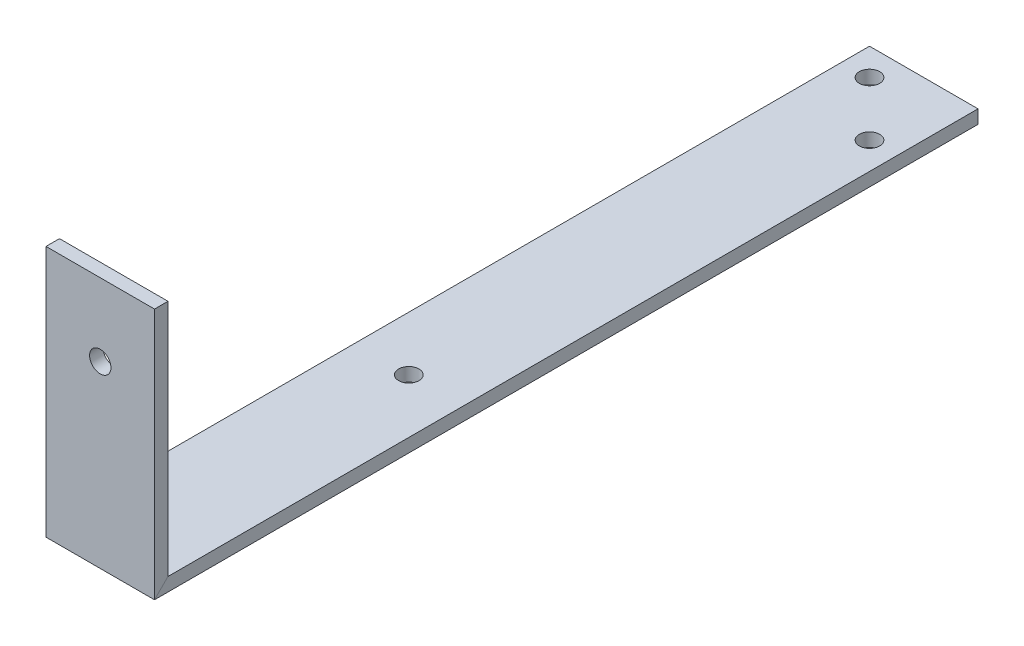
from build123d import *

# Parameters (mm, degrees)
CROQUIS2_W              = 50.8
CROQUIS2_H              = 6.31
CROQUIS3_W              = 50.8
CROQUIS3_H              = 6.31
CROQUIS4_W              = 60
CROQUIS4_H              = 53.155
SALIENTE_EXTRUIR1_DEPTH = 6.31
CROQUIS5_W              = 60
CROQUIS5_H              = 6.31
CORTAR_EXTRUIR1_DEPTH   = 6.31
CORTAR_EXTRUIR2_DEPTH   = 634
CROQUIS8_W              = 50.8
CROQUIS8_H              = 6.31
SALIENTE_EXTRUIR2_DEPTH = 63.5
CROQUIS9_R              = 5
CORTAR_EXTRUIR3_DEPTH   = 10
CROQUIS10_W             = 790.847933
CROQUIS10_H             = 6.31
CORTAR_EXTRUIR4_DEPTH   = 286
CROQUIS11_W             = 50.8
CROQUIS11_H             = 6.31
CROQUIS11_W_2           = 210
CORTAR_EXTRUIR5_DEPTH   = 13.11
CROQUIS12_W             = 50.8
CROQUIS12_H             = 6.31
SALIENTE_EXTRUIR3_DEPTH = 6.35
CROQUIS13_W             = 50.8
CROQUIS13_H             = 6.35
CORTAR_EXTRUIR6_DEPTH   = 6.35
CROQUIS14_W             = 260.8
CROQUIS14_H             = 6.31
CORTAR_EXTRUIR7_DEPTH   = 6.31
CROQUIS15_W             = 50.8
CROQUIS15_H             = 6.31
CORTAR_EXTRUIR8_DEPTH   = 6.31
CROQUIS16_W             = 78.776397836
CROQUIS16_H             = 454.479218284
CORTAR_EXTRUIR9_DEPTH   = 128
CROQUIS22_R             = 4.7625
CORTAR_EXTRUIR15_DEPTH  = 33
CROQUIS24_R             = 5.000000022
CORTAR_EXTRUIR18_DEPTH  = 33
CROQUIS25_R             = 4.7625
CORTAR_EXTRUIR19_DEPTH  = 50


with BuildPart() as part:
    # Barrer1: sweep along a curve in space
    with BuildLine() as barrer1_path:
        Line((0, 0, 0), (0, -567.24, 0))
        Line((0, -567.24, 0), (0, -567.24, 336.2))
        Line((0, -567.24, 336.2), (1786.7, -567.24, 336.2))
        Line((1786.7, -567.24, 336.2), (1786.7, -567.24, 693.16))
        Line((1786.7, -567.24, 693.16), (1786.7, -436.23, 693.16))
        Line((1786.7, -436.23, 693.16), (1786.7, -436.23, 1487.162933))
    # Croquis2 → Barrer1 (sweep)
    with BuildSketch(Plane(origin=(0, 0, 0), x_dir=(1, 0, 0), z_dir=(0, 1, 0))):
        Rectangle(CROQUIS2_W, CROQUIS2_H)
        with Locations((210, 0)):
            Rectangle(CROQUIS2_W, CROQUIS2_H)
    sweep(path=barrer1_path.line, transition=Transition.RIGHT)

    # Barrer4: sweep along a curve in space
    with BuildLine() as barrer4_path:
        Line((-0.201028049, -3.155, -3.155), (-0.201028049, -3.155, -207.155))
        Line((-0.201028049, -3.155, -207.155), (-0.201028049, -53.155, -207.155))
    # Croquis3 → Barrer4 (sweep)
    with BuildSketch(Plane(origin=(0, 0, -3.155), x_dir=(-1, 0, 0), z_dir=(0, 0, -1))):
        with Locations((-210, -3.155)):
            Rectangle(CROQUIS3_W, CROQUIS3_H)
        with Locations((0, -3.155)):
            Rectangle(CROQUIS3_W, CROQUIS3_H)
    sweep(path=barrer4_path.line, transition=Transition.RIGHT)

    # Croquis4 → Saliente-Extruir1 (add)
    with BuildSketch(Plane(origin=(0, 0, -210.31), x_dir=(-1, 0, 0), z_dir=(0, 0, -1))):
        with Locations((-154.6, -26.5775)):
            Rectangle(CROQUIS4_W, CROQUIS4_H)
    extrude(amount=-SALIENTE_EXTRUIR1_DEPTH)

    # Croquis5 → Cortar-Extruir1 (cut)
    with BuildSketch(Plane.XY.offset(-204)):
        with Locations((154.6, -3.155)):
            Rectangle(CROQUIS5_W, CROQUIS5_H)
    extrude(amount=-CORTAR_EXTRUIR1_DEPTH, mode=Mode.SUBTRACT)

    # Croquis7 → Cortar-Extruir2 (cut)
    with BuildSketch(Plane(origin=(0, 0, 0), x_dir=(1, 0, 0), z_dir=(0, 1, 0))):
        Polygon((1761.3, -361.6), (2022.1, -361.6), (2022.1, 278.600557529), (-188.115947115, 278.600557529), (-188.115947115, -361.6), align=None)
    extrude(amount=-CORTAR_EXTRUIR2_DEPTH, mode=Mode.SUBTRACT)

    # Croquis8 → Saliente-Extruir2 (add)
    with BuildSketch(Plane(origin=(0, 0, 361.6), x_dir=(-1, 0, 0), z_dir=(0, 0, -1))):
        with Locations((-1786.7, -567.24)):
            Rectangle(CROQUIS8_W, CROQUIS8_H)
    extrude(amount=SALIENTE_EXTRUIR2_DEPTH)

    # Croquis9 → Cortar-Extruir3 (cut)
    with BuildSketch(Plane(origin=(0, -433.075, 0), x_dir=(1, 0, 0), z_dir=(0, 1, 0))):
        with Locations(Location((1786.7, -1454.162933, 0), (0, 0, 270))):
            Circle(CROQUIS9_R)
        with Locations(Location((1786.7, -1234.162933, 0), (0, 0, 270))):
            Circle(CROQUIS9_R)
        with Locations(Location((1996.7, -1234.162933, 0), (0, 0, 270))):
            Circle(CROQUIS9_R)
        with Locations(Location((1996.7, -1454.162933, 0), (0, 0, 270))):
            Circle(CROQUIS9_R)
    extrude(amount=-CORTAR_EXTRUIR3_DEPTH, mode=Mode.SUBTRACT)

    # Croquis10 → Cortar-Extruir4 (cut)
    with BuildSketch(Plane(origin=(2022.1, 0, 0), x_dir=(0, 0, -1), z_dir=(1, 0, 0))):
        with Locations((-1091.7389665, -436.23)):
            Rectangle(CROQUIS10_W, CROQUIS10_H)
    extrude(amount=-CORTAR_EXTRUIR4_DEPTH, mode=Mode.SUBTRACT)

    # Croquis11 → Cortar-Extruir5 (cut)
    with BuildSketch(Plane(origin=(0, -433.075, 0), x_dir=(1, 0, 0), z_dir=(0, 1, 0))):
        with Locations((1996.7, -693.16)):
            Rectangle(CROQUIS11_W, CROQUIS11_H)
        with Locations((1866.3, -693.16)):
            Rectangle(CROQUIS11_W_2, CROQUIS11_H)
    extrude(amount=-CORTAR_EXTRUIR5_DEPTH, mode=Mode.SUBTRACT)

    # Croquis12 → Saliente-Extruir3 (add)
    with BuildSketch(Plane(origin=(0, 0, 361.6), x_dir=(-1, 0, 0), z_dir=(0, 0, -1))):
        with Locations((-1996.7, -567.24)):
            Rectangle(CROQUIS12_W, CROQUIS12_H)
    extrude(amount=SALIENTE_EXTRUIR3_DEPTH)

    # Croquis13 → Cortar-Extruir6 (cut)
    with BuildSketch(Plane(origin=(0, -564.085, 0), x_dir=(1, 0, 0), z_dir=(0, 1, 0))):
        with Locations((1786.7, -301.275)):
            Rectangle(CROQUIS13_W, CROQUIS13_H)
    extrude(amount=-CORTAR_EXTRUIR6_DEPTH, mode=Mode.SUBTRACT)

    # Croquis14 → Cortar-Extruir7 (cut)
    with BuildSketch(Plane(origin=(0, -446.185, 0), x_dir=(1, 0, 0), z_dir=(0, 1, 0))):
        with Locations((1891.7, -693.16)):
            Rectangle(CROQUIS14_W, CROQUIS14_H)
    extrude(amount=-CORTAR_EXTRUIR7_DEPTH, mode=Mode.SUBTRACT)

    # Croquis15 → Cortar-Extruir8 (cut)
    with BuildSketch(Plane(origin=(0, 0, 304.45), x_dir=(-1, 0, 0), z_dir=(0, 0, -1))):
        with Locations((-1786.7, -567.24)):
            Rectangle(CROQUIS15_W, CROQUIS15_H)
    extrude(amount=-CORTAR_EXTRUIR8_DEPTH, mode=Mode.SUBTRACT)

    # Croquis16 → Cortar-Extruir9 (cut)
    with BuildSketch(Plane(origin=(0, -452.495, 0), x_dir=(1, 0, 0), z_dir=(0, 1, 0))):
        with Locations((1993.809618139, -557.908989907)):
            Rectangle(CROQUIS16_W, CROQUIS16_H)
    extrude(amount=-CORTAR_EXTRUIR9_DEPTH, mode=Mode.SUBTRACT)

    # Croquis22 → Cortar-Extruir15 (cut)
    with BuildSketch(Plane(origin=(0, -564.085, 0), x_dir=(1, 0, 0), z_dir=(0, 1, 0))):
        with Locations(Location((1786.7, -551.855, 0), (0, 0, 270))):
            Circle(CROQUIS22_R)
    extrude(amount=-CORTAR_EXTRUIR15_DEPTH, mode=Mode.SUBTRACT)

    # Croquis24 → Cortar-Extruir18 (cut)
    with BuildSketch(Plane(origin=(0, 0, 690.005), x_dir=(-1, 0, 0), z_dir=(0, 0, -1))):
        with Locations((-1786.700000078, -486.49871274)):
            Circle(CROQUIS24_R)
    extrude(amount=-CORTAR_EXTRUIR18_DEPTH, mode=Mode.SUBTRACT)

    # Croquis25 → Cortar-Extruir19 (cut)
    with BuildSketch(Plane(origin=(0, -570.395, 0), x_dir=(-1, 0, 0), z_dir=(0, -1, 0))):
        with Locations(Location((-1799.399999999, -348.862204666, 0), (0, 0, 90))):
            Circle(CROQUIS25_R)
        with Locations(Location((-1773.999999999, -323.462204666, 0), (0, 0, 90))):
            Circle(CROQUIS25_R)
    extrude(amount=-CORTAR_EXTRUIR19_DEPTH, mode=Mode.SUBTRACT)


solid = part.part
